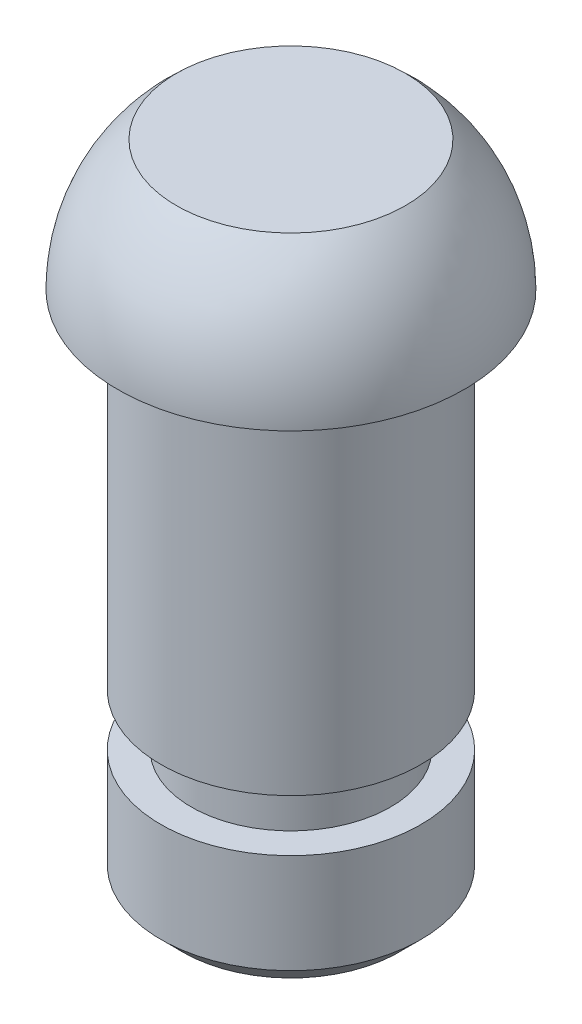
from build123d import *

# Parameters (mm, degrees)
CHAMFER1_SIZE = 0.25


with BuildPart() as part:
    # Sketch1 → Revolve1 (revolve)
    with BuildSketch(Plane.XY, mode=Mode.PRIVATE) as revolve1_sk:
        with BuildLine():
            Line((0, 0), (0, 6))
            Line((0, 6), (0, 7.5))
            Line((0, 7.5), (1.322875656, 7.5))
            ThreePointArc((1.322875656, 7.5), (1.822875656, 6.822875656), (2, 6))
            Line((2, 6), (1.5, 6))
            Line((1.5, 6), (1.5, 2))
            Line((1.5, 2), (1.15, 2))
            Line((1.15, 2), (1.15, 1.4))
            Line((1.15, 1.4), (1.5, 1.4))
            Line((1.5, 1.4), (1.5, 0))
            Line((1.5, 0), (0, 0))
        make_face()
    revolve(revolve1_sk.sketch.rotate(Axis((0, 0, 0), (0, 1, 0)), 90), axis=Axis((0, 0, 0), (0, 1, 0)))

    # Chamfer1
    chamfer1_edges = [part.edges().sort_by_distance(p)[0] for p in [
        (0, 0, 1.5),
    ]]
    chamfer(chamfer1_edges, length=CHAMFER1_SIZE)


solid = part.part
